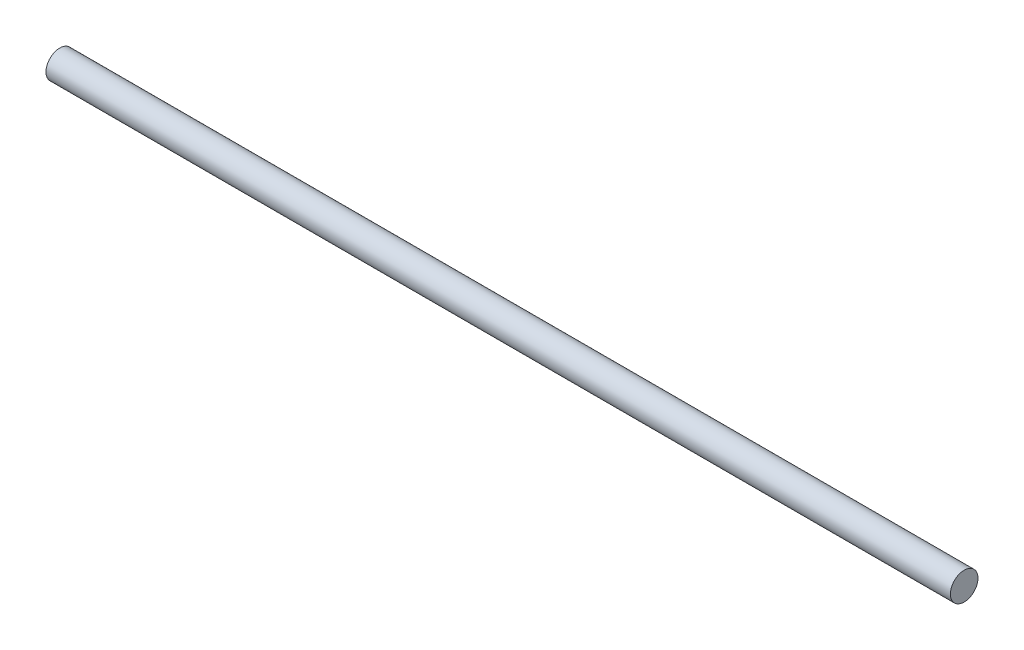
from build123d import *

# Parameters (mm, degrees)
SKETCH2_R          = 1.6
BASE_EXTRUDE_DEPTH = 104.775


with BuildPart() as part:
    # Sketch2 → Base-Extrude (new body)
    with BuildSketch(Plane(origin=(0, 0, 0), x_dir=(0, 0, -1), z_dir=(1, 0, 0))):
        Circle(SKETCH2_R)
    extrude(amount=BASE_EXTRUDE_DEPTH)


solid = part.part
